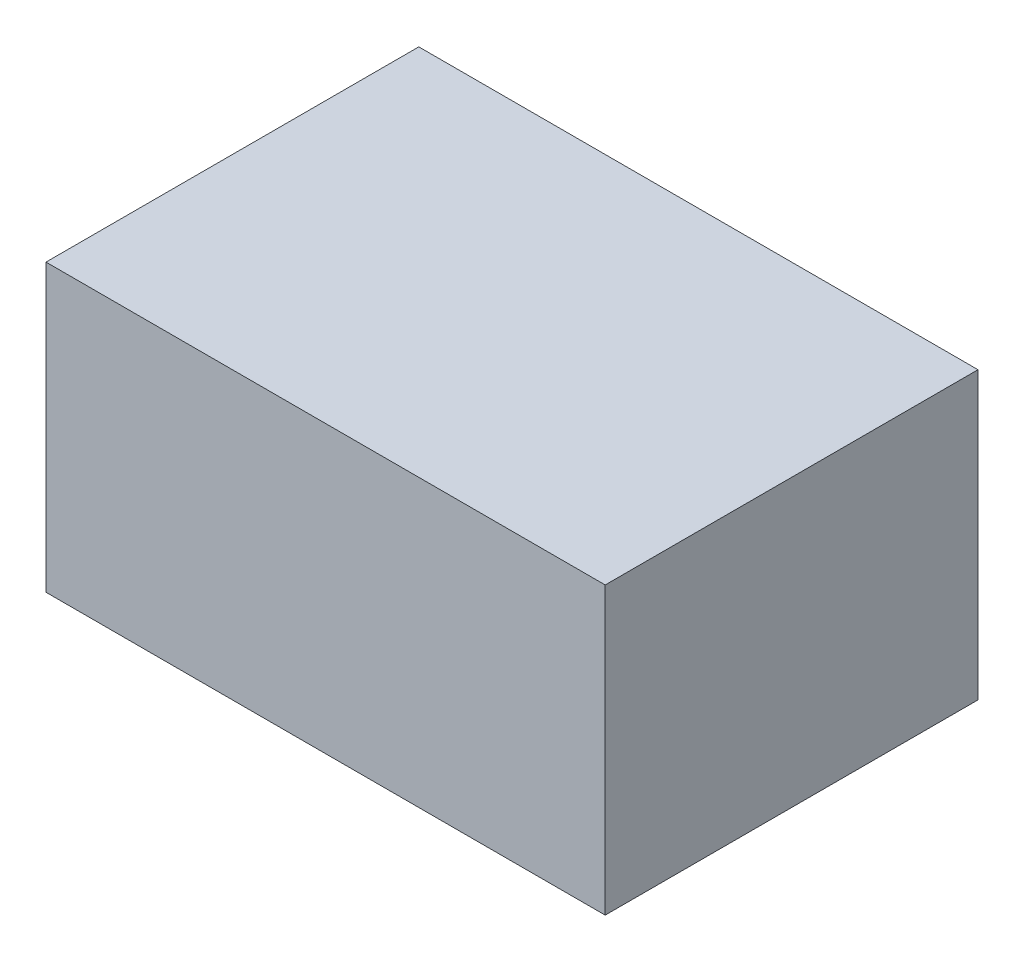
from build123d import *

# Parameters (mm, degrees)
SKETCH1_W           = 150
SKETCH1_H           = 100
BOSS_EXTRUDE1_DEPTH = 76.708


with BuildPart() as part:
    # Sketch1 → Boss-Extrude1 (new body)
    with BuildSketch(Plane(origin=(0, 0, 0), x_dir=(1, 0, 0), z_dir=(0, 1, 0))):
        with Locations((-135.772729337, 80.495312043)):
            Rectangle(SKETCH1_W, SKETCH1_H)
    extrude(amount=BOSS_EXTRUDE1_DEPTH)


solid = part.part
